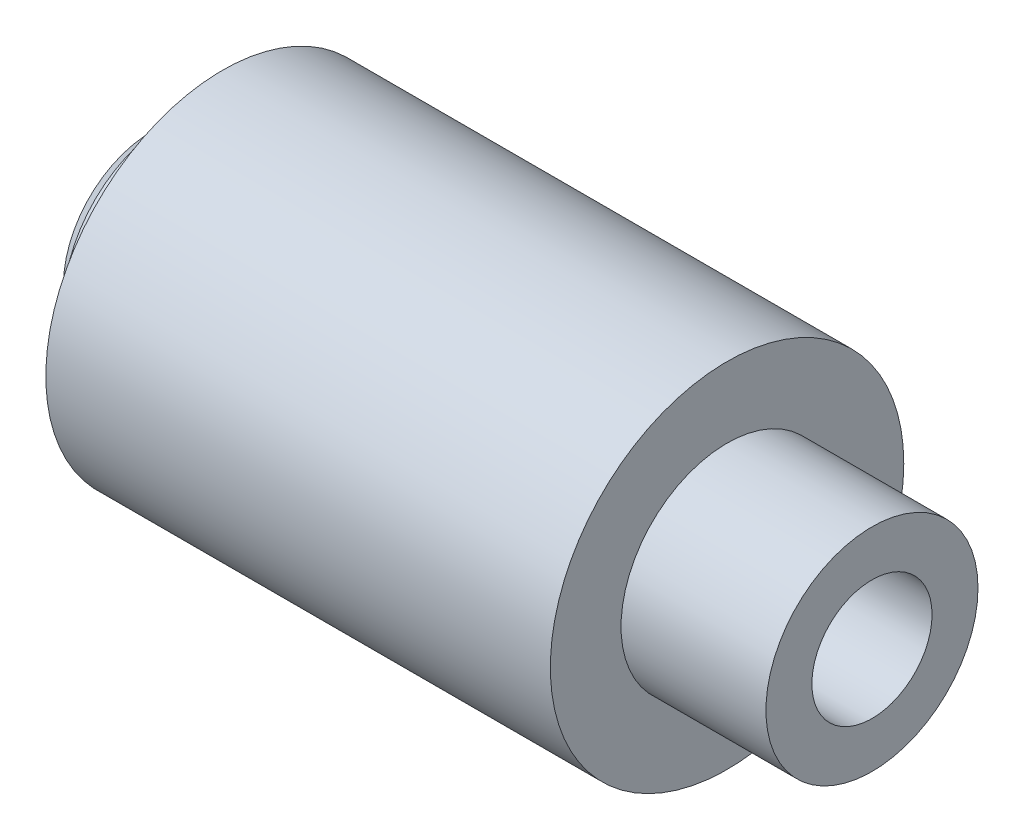
from build123d import *

# Parameters (mm, degrees)
ESQUISSE1_R        = 5
BOSS_EXTRU_1_DEPTH = 14.275
ESQUISSE5_R        = 3
BOSS_EXTRU_2_DEPTH = 2
CHANFREIN1_SIZE    = 0.5
BOSS_EXTRU_3_START = 4.1
ESQUISSE6_R        = 3
BOSS_EXTRU_3_DEPTH = 4.1
D_GAGEMENT_M32_D   = 3.4


with BuildPart() as part:
    # Esquisse1 → Boss.-Extru.1 (new body)
    with BuildSketch(Plane(origin=(0, 0, 0), x_dir=(0, 0, -1), z_dir=(1, 0, 0))):
        Circle(ESQUISSE1_R)
    extrude(amount=BOSS_EXTRU_1_DEPTH)

    # Esquisse5 → Boss.-Extru.2 (add)
    with BuildSketch(Plane.ZY):
        Circle(ESQUISSE5_R)
    extrude(amount=BOSS_EXTRU_2_DEPTH)

    # Chanfrein1
    chanfrein1_edges = [part.edges().sort_by_distance(p)[0] for p in [
        (-2, 0, -3),
    ]]
    chamfer(chanfrein1_edges, length=CHANFREIN1_SIZE)

    # Esquisse6 → Boss.-Extru.3 (add)
    with BuildSketch(Plane(origin=(14.275, 0, 0), x_dir=(0, 0, -1), z_dir=(1, 0, 0)).offset(BOSS_EXTRU_3_START)):
        with Locations(Location((0, 0, 0), (0, 0, 180))):
            Circle(ESQUISSE6_R)
    extrude(amount=-BOSS_EXTRU_3_DEPTH)

    # Dégagement M32 (through all)
    with Locations(Plane(origin=(18.375, 0, 0), x_dir=(0, 0, -1), z_dir=(1, 0, 0))):
        with Locations((0, 0)):
            Hole(D_GAGEMENT_M32_D / 2)


solid = part.part
